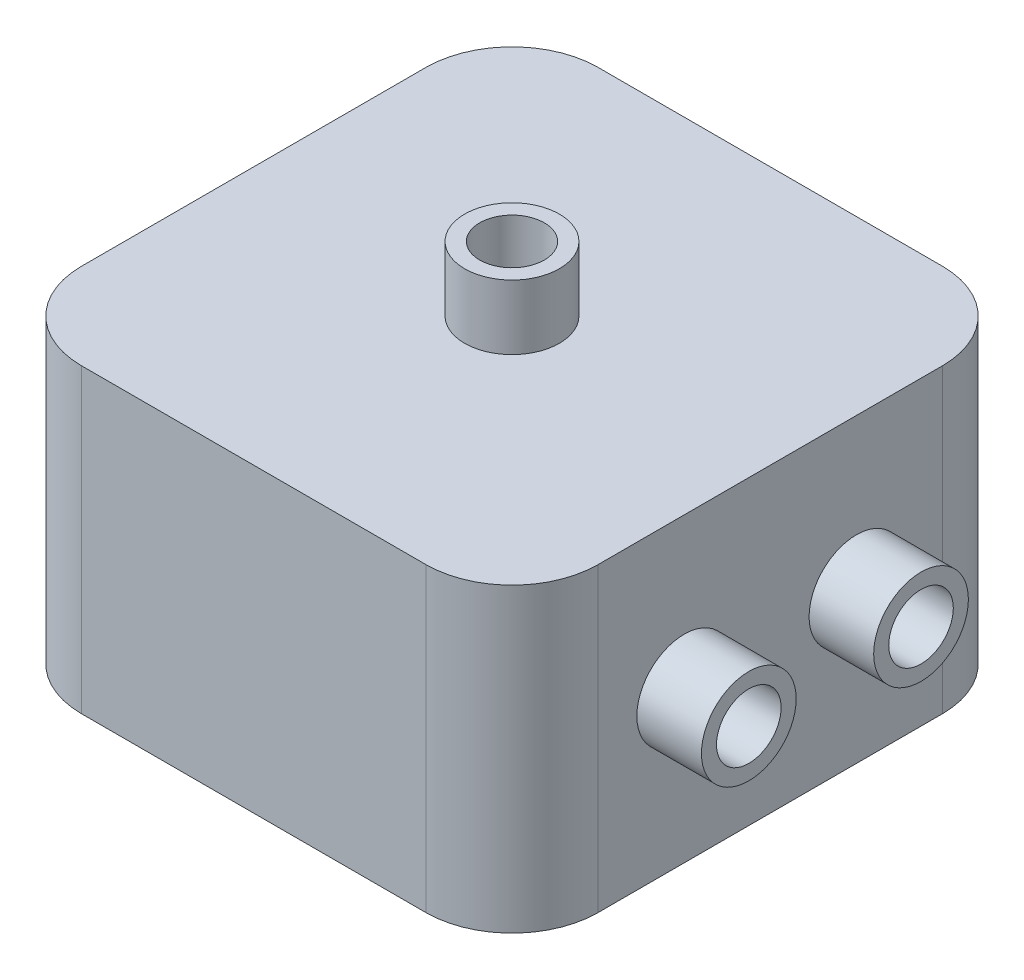
from build123d import *

# Parameters (mm, degrees)
RESSALTO_EXTRUS_O1_DEPTH = 50
RESSALTO_EXTRUS_O2_DEPTH = 10
RESSALTO_EXTRUS_O3_START = 10
RESSALTO_EXTRUS_O3_DEPTH = 10
ESBO_O4_R                = 11
RESSALTO_EXTRUS_O4_DEPTH = 15
RESSALTO_EXTRUS_O5_START = 15
ESBO_O5_R                = 11
RESSALTO_EXTRUS_O5_DEPTH = 15
ESBO_O6_R                = 7.5
CORTE_EXTRUS_O1_DEPTH    = 200
ESBO_O7_R                = 11
RESSALTO_EXTRUS_O6_DEPTH = 15
ESBO_O8_R                = 7.5
CORTE_EXTRUS_O2_DEPTH    = 30


with BuildPart() as part:
    # Esboço1 → Ressalto-extrusão1 (new body)
    with BuildSketch(Plane(origin=(0, 0, 0), x_dir=(1, 0, 0), z_dir=(0, 1, 0))):
        with BuildLine():
            Line((40, 60), (-40, 60))
            ThreePointArc((-40, 60), (-54.142135624, 54.142135624), (-60, 40))
            Line((-60, 40), (-60, -40))
            ThreePointArc((-60, -40), (-54.142135624, -54.142135624), (-40, -60))
            Line((-40, -60), (40, -60))
            ThreePointArc((40, -60), (54.142135624, -54.142135624), (60, -40))
            Line((60, -40), (60, 40))
            ThreePointArc((60, 40), (54.142135624, 54.142135624), (40, 60))
        make_face()
        with BuildLine():
            Line((40, -50), (-40, -50))
            ThreePointArc((-40, -50), (-47.071067812, -47.071067812), (-50, -40))
            Line((-50, -40), (-50, 40))
            ThreePointArc((-50, 40), (-47.071067812, 47.071067812), (-40, 50))
            Line((-40, 50), (40, 50))
            ThreePointArc((40, 50), (47.071067812, 47.071067812), (50, 40))
            Line((50, 40), (50, -40))
            ThreePointArc((50, -40), (47.071067812, -47.071067812), (40, -50))
        make_face(mode=Mode.SUBTRACT)
    extrude(amount=RESSALTO_EXTRUS_O1_DEPTH)

    # Esboço2 → Ressalto-extrusão2 (add)
    with BuildSketch(Plane(origin=(0, 50, 0), x_dir=(1, 0, 0), z_dir=(0, 1, 0))):
        with BuildLine():
            Line((-40, -60), (40, -60))
            ThreePointArc((40, -60), (54.142135624, -54.142135624), (60, -40))
            Line((60, -40), (60, 40))
            ThreePointArc((60, 40), (54.142135624, 54.142135624), (40, 60))
            Line((40, 60), (-40, 60))
            ThreePointArc((-40, 60), (-54.142135624, 54.142135624), (-60, 40))
            Line((-60, 40), (-60, -40))
            ThreePointArc((-60, -40), (-54.142135624, -54.142135624), (-40, -60))
        make_face()
    extrude(amount=RESSALTO_EXTRUS_O2_DEPTH)

    # Esboço3 → Ressalto-extrusão3 (add)
    with BuildSketch(Plane(origin=(0, 0, 0), x_dir=(-1, 0, 0), z_dir=(0, -1, 0)).offset(RESSALTO_EXTRUS_O3_START)):
        with BuildLine():
            Line((40, -60), (-40, -60))
            ThreePointArc((-40, -60), (-54.142135624, -54.142135624), (-60, -40))
            Line((-60, -40), (-60, 40))
            ThreePointArc((-60, 40), (-54.142135624, 54.142135624), (-40, 60))
            Line((-40, 60), (40, 60))
            ThreePointArc((40, 60), (54.142135624, 54.142135624), (60, 40))
            Line((60, 40), (60, -40))
            ThreePointArc((60, -40), (54.142135624, -54.142135624), (40, -60))
        make_face()
    extrude(amount=-RESSALTO_EXTRUS_O3_DEPTH)

    # Esboço4 → Ressalto-extrusão4 (add)
    with BuildSketch(Plane.ZY.offset(60)):
        with Locations(Location((20, 25, 0), (0, 0, 180))):
            Circle(ESBO_O4_R)
        with Locations(Location((-20, 25, 0), (0, 0, 180))):
            Circle(ESBO_O4_R)
    extrude(amount=RESSALTO_EXTRUS_O4_DEPTH)

    # Esboço5 → Ressalto-extrusão5 (add)
    with BuildSketch(Plane(origin=(60, 0, 0), x_dir=(0, 0, -1), z_dir=(1, 0, 0)).offset(RESSALTO_EXTRUS_O5_START)):
        with Locations((-20, 25)):
            Circle(ESBO_O5_R)
        with Locations((20, 25)):
            Circle(ESBO_O5_R)
    extrude(amount=-RESSALTO_EXTRUS_O5_DEPTH)

    # Esboço6 → Corte-extrusão1 (cut)
    with BuildSketch(Plane.ZY.offset(75)):
        with Locations((20, 25)):
            Circle(ESBO_O6_R)
        with Locations((-20, 25)):
            Circle(ESBO_O6_R)
    extrude(amount=-CORTE_EXTRUS_O1_DEPTH, mode=Mode.SUBTRACT)

    # Esboço7 → Ressalto-extrusão6 (add)
    with BuildSketch(Plane(origin=(0, 60, 0), x_dir=(1, 0, 0), z_dir=(0, 1, 0))):
        with Locations(Location((0, 0, 0), (0, 0, 270))):
            Circle(ESBO_O7_R)
    extrude(amount=RESSALTO_EXTRUS_O6_DEPTH)

    # Esboço8 → Corte-extrusão2 (cut)
    with BuildSketch(Plane(origin=(0, 75, 0), x_dir=(1, 0, 0), z_dir=(0, 1, 0))):
        with Locations(Location((0, 0, 0), (0, 0, 270))):
            Circle(ESBO_O8_R)
    extrude(amount=-CORTE_EXTRUS_O2_DEPTH, mode=Mode.SUBTRACT)


solid = part.part
